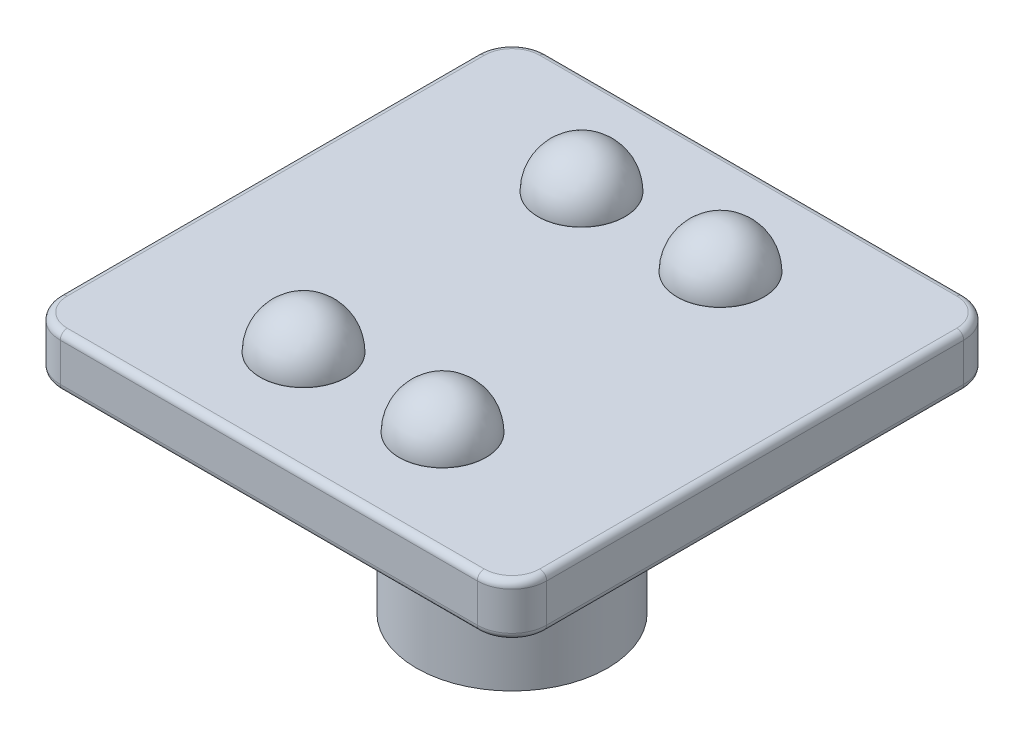
from build123d import *

# Parameters (mm, degrees)
BOSS_EXTRUDE1_DEPTH = 1.5
SKETCH2_R           = 2.75
BOSS_EXTRUDE2_DEPTH = 6
SKETCH3_W           = 1.1
SKETCH3_H           = 1.45
SKETCH3_W_2         = 1.45
SKETCH3_H_2         = 1.1
CUT_EXTRUDE1_DEPTH  = 6
CHAMFER1_SIZE       = 0.3
FILLET1_R           = 1
SKETCH4_R           = 1.25
BOSS_EXTRUDE3_DEPTH = 0.01
DOME1_FACE_RADIUS   = 1.25
DOME1_HEIGHT        = 1.25
DOME2_FACE_RADIUS   = 1.25
DOME2_HEIGHT        = 1.25
DOME5_FACE_RADIUS   = 1.25
DOME5_HEIGHT        = 1.25
DOME6_FACE_RADIUS   = 1.25
DOME6_HEIGHT        = 1.25
FILLET3_R           = 0.2


with BuildPart() as part:
    # Sketch1 → Boss-Extrude1 (new body)
    with BuildSketch(Plane(origin=(0, 0, 0), x_dir=(1, 0, 0), z_dir=(0, 1, 0))):
        with BuildLine():
            Line((-7.324675649, 4.396717546), (4.675324351, 4.396717546))
            ThreePointArc((4.675324351, 4.396717546), (5.382431132, 4.103824327), (5.675324351, 3.396717546))
            Line((5.675324351, 3.396717546), (5.675324351, -8.603282454))
            ThreePointArc((5.675324351, -8.603282454), (5.382431132, -9.310389235), (4.675324351, -9.603282454))
            Line((4.675324351, -9.603282454), (-7.324675649, -9.603282454))
            ThreePointArc((-7.324675649, -9.603282454), (-8.03178243, -9.310389235), (-8.324675649, -8.603282454))
            Line((-8.324675649, -8.603282454), (-8.324675649, 3.396717546))
            ThreePointArc((-8.324675649, 3.396717546), (-8.03178243, 4.103824327), (-7.324675649, 4.396717546))
        make_face()
    extrude(amount=BOSS_EXTRUDE1_DEPTH)

    # Sketch2 → Boss-Extrude2 (add)
    with BuildSketch(Plane.XZ):
        with Locations(Location((-1.324675649, 2.603282454, 0), (0, 0, 270))):
            Circle(SKETCH2_R)
    extrude(amount=BOSS_EXTRUDE2_DEPTH)

    # Sketch3 → Cut-Extrude1 (cut)
    with BuildSketch(Plane.XZ.offset(6)):
        with Locations((-1.324675649, 3.878282454)):
            Rectangle(SKETCH3_W, SKETCH3_H)
        with Locations((-0.049675649, 2.603282454)):
            Rectangle(SKETCH3_W_2, SKETCH3_H_2)
        with Locations((-1.324675649, 2.603282454)):
            Rectangle(SKETCH3_W, SKETCH3_H_2)
        with Locations((-2.599675649, 2.603282454)):
            Rectangle(SKETCH3_W_2, SKETCH3_H_2)
        with Locations((-1.324675649, 1.328282454)):
            Rectangle(SKETCH3_W, SKETCH3_H)
    extrude(amount=-CUT_EXTRUDE1_DEPTH, mode=Mode.SUBTRACT)

    # Chamfer1
    chamfer1_edges = [part.edges().sort_by_distance(p)[0] for p in [
        (-0.774675649, -6, 3.878282454),
        (-0.049675649, -6, 3.153282454),
        (0.675324351, -6, 2.603282454),
        (-0.774675649, -6, 1.328282454),
        (-2.599675649, -6, 3.153282454),
        (-1.324675649, -6, 4.603282454),
        (-1.874675649, -6, 3.878282454),
        (-3.324675649, -6, 2.603282454),
        (-2.599675649, -6, 2.053282454),
        (-1.874675649, -6, 1.328282454),
        (-1.324675649, -6, 0.603282454),
        (-0.049675649, -6, 2.053282454),
    ]]
    chamfer(chamfer1_edges, length=CHAMFER1_SIZE)

    # Fillet1
    fillet1_edges = [part.edges().sort_by_distance(p)[0] for p in [
        (-1.324675649, 0, 5.353282454),
    ]]
    fillet(fillet1_edges, radius=FILLET1_R)

    # Sketch4 → Boss-Extrude3 (add)
    with BuildSketch(Plane(origin=(0, 1.5, 0), x_dir=(1, 0, 0), z_dir=(0, 1, 0))):
        with Locations(Location((-3.324675649, 1.396717546, 0), (0, 0, 90))):
            Circle(SKETCH4_R)
        with Locations(Location((-3.324675649, -6.603282454, 0), (0, 0, 90))):
            Circle(SKETCH4_R)
        with Locations(Location((0.675324351, -6.603282454, 0), (0, 0, 90))):
            Circle(SKETCH4_R)
        with Locations(Location((0.675324351, 1.396717546, 0), (0, 0, 90))):
            Circle(SKETCH4_R)
    extrude(amount=BOSS_EXTRUDE3_DEPTH)

    # Dome1: a dome of height H over a round flat face of radius A is a cap of a sphere of radius (A * A + H * H) / (2 * H)
    dome1_r = (DOME1_FACE_RADIUS * DOME1_FACE_RADIUS + DOME1_HEIGHT * DOME1_HEIGHT) / (2 * DOME1_HEIGHT)
    dome1_base = Plane((-3.324675649, 1.51, -1.396717546), z_dir=(0, 1, 0))
    with Locations(dome1_base.offset(DOME1_HEIGHT - dome1_r)):
        dome1_ball = Sphere(dome1_r, mode=Mode.PRIVATE)
    add(split(dome1_ball, bisect_by=dome1_base, keep=Keep.TOP, mode=Mode.PRIVATE))

    # Dome2: a dome of height H over a round flat face of radius A is a cap of a sphere of radius (A * A + H * H) / (2 * H)
    dome2_r = (DOME2_FACE_RADIUS * DOME2_FACE_RADIUS + DOME2_HEIGHT * DOME2_HEIGHT) / (2 * DOME2_HEIGHT)
    dome2_base = Plane((0.675324351, 1.51, -1.396717546), z_dir=(0, 1, 0))
    with Locations(dome2_base.offset(DOME2_HEIGHT - dome2_r)):
        dome2_ball = Sphere(dome2_r, mode=Mode.PRIVATE)
    add(split(dome2_ball, bisect_by=dome2_base, keep=Keep.TOP, mode=Mode.PRIVATE))

    # Dome5: a dome of height H over a round flat face of radius A is a cap of a sphere of radius (A * A + H * H) / (2 * H)
    dome5_r = (DOME5_FACE_RADIUS * DOME5_FACE_RADIUS + DOME5_HEIGHT * DOME5_HEIGHT) / (2 * DOME5_HEIGHT)
    dome5_base = Plane((-3.324675649, 1.51, 6.603282454), z_dir=(0, 1, 0))
    with Locations(dome5_base.offset(DOME5_HEIGHT - dome5_r)):
        dome5_ball = Sphere(dome5_r, mode=Mode.PRIVATE)
    add(split(dome5_ball, bisect_by=dome5_base, keep=Keep.TOP, mode=Mode.PRIVATE))

    # Dome6: a dome of height H over a round flat face of radius A is a cap of a sphere of radius (A * A + H * H) / (2 * H)
    dome6_r = (DOME6_FACE_RADIUS * DOME6_FACE_RADIUS + DOME6_HEIGHT * DOME6_HEIGHT) / (2 * DOME6_HEIGHT)
    dome6_base = Plane((0.675324351, 1.51, 6.603282454), z_dir=(0, 1, 0))
    with Locations(dome6_base.offset(DOME6_HEIGHT - dome6_r)):
        dome6_ball = Sphere(dome6_r, mode=Mode.PRIVATE)
    add(split(dome6_ball, bisect_by=dome6_base, keep=Keep.TOP, mode=Mode.PRIVATE))

    # Fillet3
    fillet3_edges = [part.edges().sort_by_distance(p)[0] for p in [
        (5.382431132, 1.5, 9.310389235),
        (-1.324675649, 0, 9.603282454),
        (-8.03178243, 0, 9.310389235),
        (5.675324351, 1.5, 2.603282454),
        (5.382431132, 1.5, -4.103824327),
        (-1.324675649, 1.5, -4.396717546),
        (-8.03178243, 1.5, -4.103824327),
        (-8.324675649, 1.5, 2.603282454),
        (-8.03178243, 1.5, 9.310389235),
        (-1.324675649, 1.5, 9.603282454),
        (-8.324675649, 0, 2.603282454),
        (-8.03178243, 0, -4.103824327),
        (-1.324675649, 0, -4.396717546),
        (5.382431132, 0, -4.103824327),
        (5.675324351, 0, 2.603282454),
        (5.382431132, 0, 9.310389235),
    ]]
    fillet(fillet3_edges, radius=FILLET3_R)


solid = part.part
